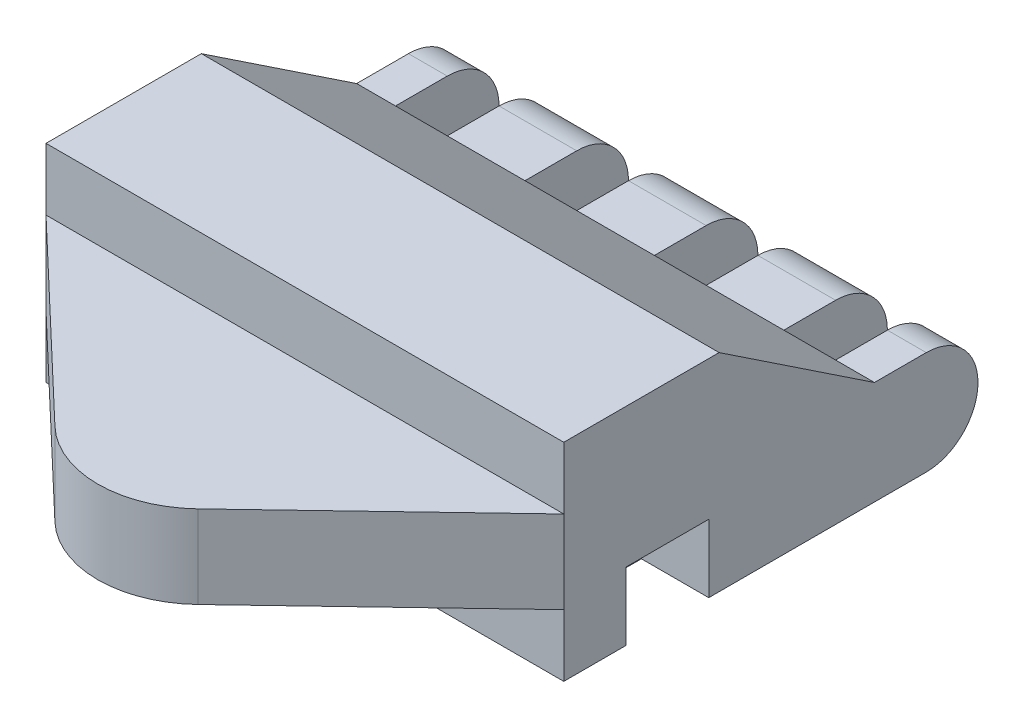
from build123d import *

# Parameters (mm, degrees)
EXTRUDE_1_DEPTH     = 20
SKETCH_2_W          = 106.736402143
SKETCH_2_H          = 47.429352318
CUT_EXTRUDE_1_DEPTH = 12
SKETCH_3_W          = 102.678215223
SKETCH_3_H          = 46.458192726
CUT_EXTRUDE_2_DEPTH = 12
CUT_EXTRUDE_3_DEPTH = 130.614813968
CUT_EXTRUDE_4_DEPTH = 16
EXTRUDE_4_DEPTH     = 100
SKETCH_8_W          = 10
SKETCH_8_H          = 20
CUT_EXTRUDE_6_DEPTH = 100
CUT_EXTRUDE_7_DEPTH = 16


with BuildPart() as part:
    # 草图1 → 凸台-拉伸1 (new, symmetric)
    with BuildSketch(Plane(origin=(0, 0, 0), x_dir=(1, 0, 0), z_dir=(0, 1, 0))):
        with BuildLine():
            Line((-50, 20), (-13.793103448, -14.482758621))
            ThreePointArc((-13.793103448, -14.482758621), (0, -20), (13.793103448, -14.482758621))
            Line((13.793103448, -14.482758621), (50, 20))
            Line((50, 20), (50, 80))
            Line((50, 80), (-50, 80))
            Line((-50, 80), (-50, 20))
        make_face()
    extrude(amount=EXTRUDE_1_DEPTH, both=True)

    # 草图2 → 切除-拉伸1 (cut)
    with BuildSketch(Plane(origin=(0, 20, 0), x_dir=(1, 0, 0), z_dir=(0, 1, 0))):
        with Locations((3.368201072, -3.714676159)):
            Rectangle(SKETCH_2_W, SKETCH_2_H)
    extrude(amount=-CUT_EXTRUDE_1_DEPTH, mode=Mode.SUBTRACT)

    # 草图3 → 切除-拉伸2 (cut)
    with BuildSketch(Plane.XZ.offset(20)):
        with Locations((1.339107612, 3.229096363)):
            Rectangle(SKETCH_3_W, SKETCH_3_H)
    extrude(amount=-CUT_EXTRUDE_2_DEPTH, mode=Mode.SUBTRACT)

    # 草图4 → 切除-拉伸3 (cut, through all)
    with BuildSketch(Plane(origin=(50, 0, 0), x_dir=(0, 0, -1), z_dir=(1, 0, 0))):
        Polygon((80, 0), (50, 20), (88.61691531, 20), (88.61691531, 0), align=None)
    extrude(amount=-CUT_EXTRUDE_3_DEPTH, mode=Mode.SUBTRACT)

    # Sketch 3D_1 → 切除-拉伸4 (cut)
    with BuildSketch(Plane(origin=(37, -14.910720316, -32), x_dir=(0.9127147422515467, 0.40859735593453445, 0), z_dir=(0, 0, -1))):
        with BuildLine():
            Line((0, 0), (-3.444952044, 7.6952493))
            Line((-3.444952044, 7.6952493), (4.401902282, 10.724720717))
            ThreePointArc((4.401902282, 10.724720717), (10.279015254, 10.694120637), (14.549253267, 6.655994763))
            Line((14.549253267, 6.655994763), (19.7295953, 0))
            Line((19.7295953, 0), (10.525702717, -4.05282768))
            ThreePointArc((10.525702717, -4.05282768), (4.4271171, -4.196920719), (0, 0))
        make_face()
    extrude(amount=CUT_EXTRUDE_4_DEPTH, mode=Mode.SUBTRACT)

    # 草图6 → 凸台-拉伸4 (add)
    with BuildSketch(Plane.ZY.offset(50)):
        with BuildLine():
            Line((-90, 0), (-80, 0))
            Line((-80, 0), (-80, -20))
            Line((-80, -20), (-90, -20))
            ThreePointArc((-90, -20), (-100, -10), (-90, 0))
        make_face()
    extrude(amount=-EXTRUDE_4_DEPTH)

    # 草图8 → 切除-拉伸6 (cut)
    with BuildSketch(Plane.XZ.offset(20)):
        with Locations((-37.5, -90)):
            Rectangle(SKETCH_8_W, SKETCH_8_H)
        with Locations((-12.5, -90)):
            Rectangle(SKETCH_8_W, SKETCH_8_H)
        with Locations((12.5, -90)):
            Rectangle(SKETCH_8_W, SKETCH_8_H)
        with Locations((37.5, -90)):
            Rectangle(SKETCH_8_W, SKETCH_8_H)
    extrude(amount=-CUT_EXTRUDE_6_DEPTH, mode=Mode.SUBTRACT)

    # 草图9 → 切除-拉伸7 (cut)
    with BuildSketch(Plane(origin=(0, 0, -32), x_dir=(-1, 0, 0), z_dir=(0, 0, -1))):
        with BuildLine():
            Line((45, -7), (50, -7))
            Line((50, -7), (59.459591305, -7))
            Line((59.459591305, -7), (59.459591305, -23))
            Line((59.459591305, -23), (37, -23))
            Line((37, -23), (37, -15))
            ThreePointArc((37, -15), (39.343145751, -9.343145751), (45, -7))
        make_face()
    extrude(amount=CUT_EXTRUDE_7_DEPTH, mode=Mode.SUBTRACT)


solid = part.part
